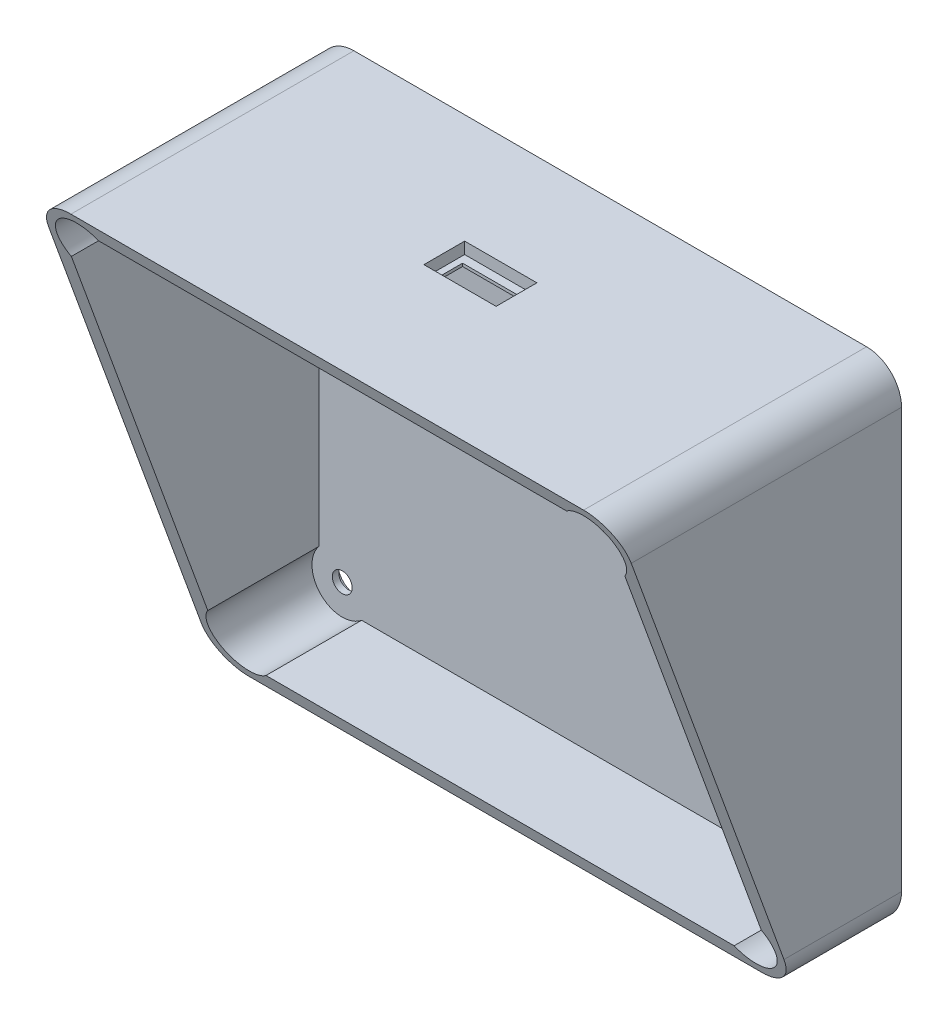
from build123d import *

# Parameters (mm, degrees)
OUTER_R6_DEPTH                         = 55
CAVITY_FLOOR2P5_WALL2P5_START          = 2.5
CAVITY_FLOOR2P5_WALL2P5_DEPTH          = 65
PANEL_SEAT_20DEG_DEPTH                 = 142.707445111
PANEL_SEAT_20DEG_DEPTH_BACK            = 142.707445111
INTERNAL_POST_CLEARANCE_0_START        = 2.5
SKETCH_4_R                             = 5.2
INTERNAL_POST_CLEARANCE_0_DEPTH        = 60
SKETCH_5_R                             = 1.7
UNDERSIDE_M3_0_DEPTH                   = 3
SKETCH_6_R                             = 3.3
UNDERSIDE_HEAD_RECESS_0_DEPTH          = 1.4
INTERNAL_POST_CLEARANCE_1_START        = 2.5
SKETCH_7_R                             = 5.2
INTERNAL_POST_CLEARANCE_1_DEPTH        = 60
SKETCH_8_R                             = 1.7
UNDERSIDE_M3_1_DEPTH                   = 3
SKETCH_9_R                             = 3.3
UNDERSIDE_HEAD_RECESS_1_DEPTH          = 1.4
INTERNAL_POST_CLEARANCE_2_START        = 2.5
SKETCH_10_R                            = 5.2
INTERNAL_POST_CLEARANCE_2_DEPTH        = 60
SKETCH_11_R                            = 1.7
UNDERSIDE_M3_2_DEPTH                   = 3
SKETCH_12_R                            = 3.3
UNDERSIDE_HEAD_RECESS_2_DEPTH          = 1.4
INTERNAL_POST_CLEARANCE_3_START        = 2.5
SKETCH_13_R                            = 5.2
INTERNAL_POST_CLEARANCE_3_DEPTH        = 60
SKETCH_14_R                            = 1.7
UNDERSIDE_M3_3_DEPTH                   = 3
SKETCH_15_R                            = 3.3
UNDERSIDE_HEAD_RECESS_3_DEPTH          = 1.4
CENTERED_CARRIER_SUPPORTS_Z7_START     = 2.5
SKETCH_16_R                            = 2.2
CENTERED_CARRIER_SUPPORTS_Z7_DEPTH     = 4.5
SKETCH_17_R                            = 1.15
CARRIER_M2_CLEARANCE_DEPTH             = 8
SKETCH_18_R                            = 2.2
CARRIER_HEAD_RECESS_DEPTH              = 1.2
USB_C_CENTERED_INNER_OPENING_START     = 80
SKETCH_19_W                            = 10.2
SKETCH_19_H                            = 4.08
USB_C_CENTERED_INNER_OPENING_DEPTH     = 6
USB_PLUG_SHOULDER_SHALLOW_RECESS_START = 82
SKETCH_20_W                            = 12.4
SKETCH_20_H                            = 7
USB_PLUG_SHOULDER_SHALLOW_RECESS_DEPTH = 3


with BuildPart() as part:
    # 草图1 → Outer_R6 (new body)
    with BuildSketch(Plane.XY):
        with BuildLine():
            Line((6, 0), (94, 0))
            ThreePointArc((94, 0), (98.242640687, 1.757359313), (100, 6))
            Line((100, 6), (100, 78))
            ThreePointArc((100, 78), (98.242640687, 82.242640687), (94, 84))
            Line((94, 84), (6, 84))
            ThreePointArc((6, 84), (1.757359313, 82.242640687), (0, 78))
            Line((0, 78), (0, 6))
            ThreePointArc((0, 6), (1.757359313, 1.757359313), (6, 0))
        make_face()
    extrude(amount=OUTER_R6_DEPTH)

    # 草图2 → Cavity_floor2p5_wall2p5 (cut)
    with BuildSketch(Plane.XY.offset(CAVITY_FLOOR2P5_WALL2P5_START)):
        with BuildLine():
            Line((6, 2.5), (94, 2.5))
            ThreePointArc((94, 2.5), (96.474873734, 3.525126266), (97.5, 6))
            Line((97.5, 6), (97.5, 78))
            ThreePointArc((97.5, 78), (96.474873734, 80.474873734), (94, 81.5))
            Line((94, 81.5), (6, 81.5))
            ThreePointArc((6, 81.5), (3.525126266, 80.474873734), (2.5, 78))
            Line((2.5, 78), (2.5, 6))
            ThreePointArc((2.5, 6), (3.525126266, 3.525126266), (6, 2.5))
        make_face()
    extrude(amount=CAVITY_FLOOR2P5_WALL2P5_DEPTH, mode=Mode.SUBTRACT)

    # 草图3 → Panel_seat_20deg (cut, two sides: drawn at the far end of the back side and taken through both)
    with BuildSketch(Plane(origin=(0, 0, 0), x_dir=(0, 0, -1), z_dir=(1, 0, 0)).offset(-PANEL_SEAT_20DEG_DEPTH_BACK)):
        Polygon((-10.720595315, -20), (-58.036725769, 110), (-120, 110), (-120, -20), align=None)
    extrude(amount=PANEL_SEAT_20DEG_DEPTH + PANEL_SEAT_20DEG_DEPTH_BACK, mode=Mode.SUBTRACT)

    # 草图4 → Internal_post_clearance_0 (cut)
    with BuildSketch(Plane.XY.offset(INTERNAL_POST_CLEARANCE_0_START)):
        with Locations((6.5, 6.5)):
            Circle(SKETCH_4_R)
    extrude(amount=INTERNAL_POST_CLEARANCE_0_DEPTH, mode=Mode.SUBTRACT)

    # 草图5 → Underside_M3_0 (cut)
    with BuildSketch(Plane.XY):
        with Locations((6.5, 6.5)):
            Circle(SKETCH_5_R)
    extrude(amount=UNDERSIDE_M3_0_DEPTH, mode=Mode.SUBTRACT)

    # 草图6 → Underside_head_recess_0 (cut)
    with BuildSketch(Plane.XY):
        with Locations((6.5, 6.5)):
            Circle(SKETCH_6_R)
    extrude(amount=UNDERSIDE_HEAD_RECESS_0_DEPTH, mode=Mode.SUBTRACT)

    # 草图7 → Internal_post_clearance_1 (cut)
    with BuildSketch(Plane.XY.offset(INTERNAL_POST_CLEARANCE_1_START)):
        with Locations((93.5, 6.5)):
            Circle(SKETCH_7_R)
    extrude(amount=INTERNAL_POST_CLEARANCE_1_DEPTH, mode=Mode.SUBTRACT)

    # 草图8 → Underside_M3_1 (cut)
    with BuildSketch(Plane.XY):
        with Locations((93.5, 6.5)):
            Circle(SKETCH_8_R)
    extrude(amount=UNDERSIDE_M3_1_DEPTH, mode=Mode.SUBTRACT)

    # 草图9 → Underside_head_recess_1 (cut)
    with BuildSketch(Plane.XY):
        with Locations((93.5, 6.5)):
            Circle(SKETCH_9_R)
    extrude(amount=UNDERSIDE_HEAD_RECESS_1_DEPTH, mode=Mode.SUBTRACT)

    # 草图10 → Internal_post_clearance_2 (cut)
    with BuildSketch(Plane.XY.offset(INTERNAL_POST_CLEARANCE_2_START)):
        with Locations((6.5, 77.5)):
            Circle(SKETCH_10_R)
    extrude(amount=INTERNAL_POST_CLEARANCE_2_DEPTH, mode=Mode.SUBTRACT)

    # 草图11 → Underside_M3_2 (cut)
    with BuildSketch(Plane.XY):
        with Locations((6.5, 77.5)):
            Circle(SKETCH_11_R)
    extrude(amount=UNDERSIDE_M3_2_DEPTH, mode=Mode.SUBTRACT)

    # 草图12 → Underside_head_recess_2 (cut)
    with BuildSketch(Plane.XY):
        with Locations((6.5, 77.5)):
            Circle(SKETCH_12_R)
    extrude(amount=UNDERSIDE_HEAD_RECESS_2_DEPTH, mode=Mode.SUBTRACT)

    # 草图13 → Internal_post_clearance_3 (cut)
    with BuildSketch(Plane.XY.offset(INTERNAL_POST_CLEARANCE_3_START)):
        with Locations((93.5, 77.5)):
            Circle(SKETCH_13_R)
    extrude(amount=INTERNAL_POST_CLEARANCE_3_DEPTH, mode=Mode.SUBTRACT)

    # 草图14 → Underside_M3_3 (cut)
    with BuildSketch(Plane.XY):
        with Locations((93.5, 77.5)):
            Circle(SKETCH_14_R)
    extrude(amount=UNDERSIDE_M3_3_DEPTH, mode=Mode.SUBTRACT)

    # 草图15 → Underside_head_recess_3 (cut)
    with BuildSketch(Plane.XY):
        with Locations((93.5, 77.5)):
            Circle(SKETCH_15_R)
    extrude(amount=UNDERSIDE_HEAD_RECESS_3_DEPTH, mode=Mode.SUBTRACT)

    # 草图16 → Centered_carrier_supports_Z7 (add)
    with BuildSketch(Plane.XY.offset(CENTERED_CARRIER_SUPPORTS_Z7_START)):
        with Locations((37, 49)):
            Circle(SKETCH_16_R)
        with Locations((63, 49)):
            Circle(SKETCH_16_R)
        with Locations((37, 78)):
            Circle(SKETCH_16_R)
        with Locations((63, 78)):
            Circle(SKETCH_16_R)
    extrude(amount=CENTERED_CARRIER_SUPPORTS_Z7_DEPTH)

    # 草图17 → Carrier_M2_clearance (cut)
    with BuildSketch(Plane.XY):
        with Locations((37, 49)):
            Circle(SKETCH_17_R)
        with Locations((63, 49)):
            Circle(SKETCH_17_R)
        with Locations((37, 78)):
            Circle(SKETCH_17_R)
        with Locations((63, 78)):
            Circle(SKETCH_17_R)
    extrude(amount=CARRIER_M2_CLEARANCE_DEPTH, mode=Mode.SUBTRACT)

    # 草图18 → Carrier_head_recess (cut)
    with BuildSketch(Plane.XY):
        with Locations((37, 49)):
            Circle(SKETCH_18_R)
        with Locations((63, 49)):
            Circle(SKETCH_18_R)
        with Locations((37, 78)):
            Circle(SKETCH_18_R)
        with Locations((63, 78)):
            Circle(SKETCH_18_R)
    extrude(amount=CARRIER_HEAD_RECESS_DEPTH, mode=Mode.SUBTRACT)

    # 草图19 → USB_C_centered_inner_opening (cut)
    with BuildSketch(Plane(origin=(0, 0, 0), x_dir=(1, 0, 0), z_dir=(0, 1, 0)).offset(USB_C_CENTERED_INNER_OPENING_START)):
        with Locations((50, -22.29)):
            Rectangle(SKETCH_19_W, SKETCH_19_H)
    extrude(amount=USB_C_CENTERED_INNER_OPENING_DEPTH, mode=Mode.SUBTRACT)

    # 草图20 → USB_plug_shoulder_shallow_recess (cut)
    with BuildSketch(Plane(origin=(0, 0, 0), x_dir=(1, 0, 0), z_dir=(0, 1, 0)).offset(USB_PLUG_SHOULDER_SHALLOW_RECESS_START)):
        with Locations((50, -22.29)):
            Rectangle(SKETCH_20_W, SKETCH_20_H)
    extrude(amount=USB_PLUG_SHOULDER_SHALLOW_RECESS_DEPTH, mode=Mode.SUBTRACT)


solid = part.part
